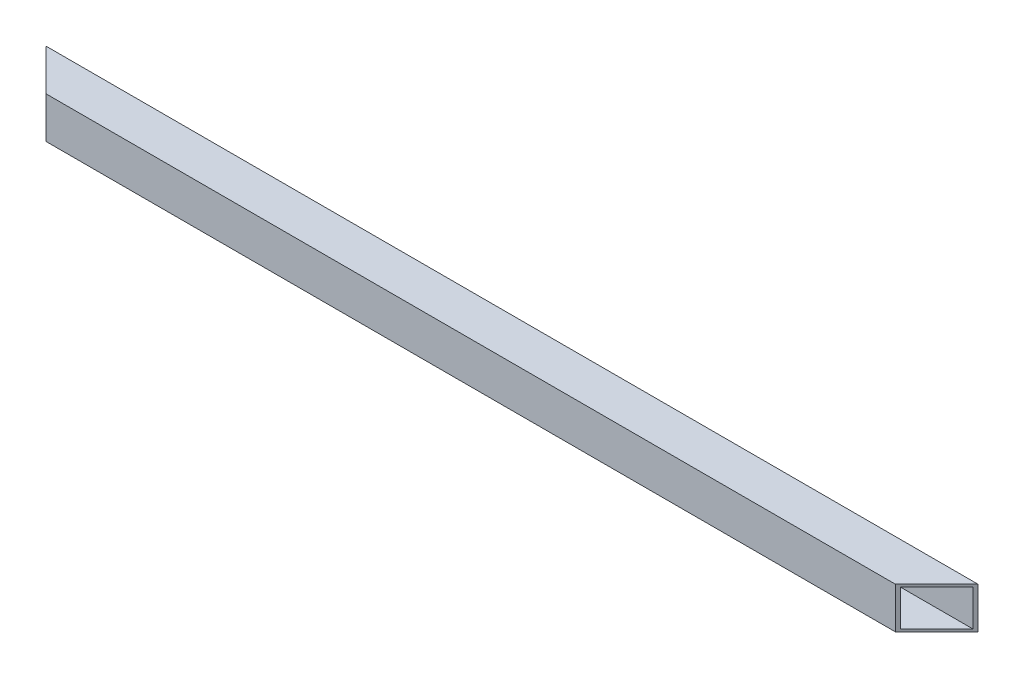
from build123d import *

# Parameters (mm, degrees)
SKETCH1_W               = 19.05
SKETCH1_H               = 19.05
BOSS_EXTRUDE1_DEPTH     = 215
SKETCH2_W               = 16.65
SKETCH2_H               = 16.65
CUT_EXTRUDE1_DEPTH      = 431.210938087
CUT_EXTRUDE2_DEPTH      = 216.421566353
CUT_EXTRUDE2_DEPTH_BACK = 216.421566353


with BuildPart() as part:
    # Sketch1 → Boss-Extrude1 (new, symmetric)
    with BuildSketch(Plane(origin=(0, 0, 0), x_dir=(0, 0, -1), z_dir=(1, 0, 0))):
        Rectangle(SKETCH1_W, SKETCH1_H)
    extrude(amount=BOSS_EXTRUDE1_DEPTH, both=True)

    # Sketch2 → Cut-Extrude1 (cut, through all)
    with BuildSketch(Plane.ZY.offset(215)):
        Rectangle(SKETCH2_W, SKETCH2_H)
    extrude(amount=-CUT_EXTRUDE1_DEPTH, mode=Mode.SUBTRACT)

    # Sketch3 → Cut-Extrude2 (cut, two sides: drawn at the far end of the back side and taken through both)
    with BuildSketch(Plane(origin=(0, 0, 0), x_dir=(1, 0, 0), z_dir=(0, 1, 0)).offset(-CUT_EXTRUDE2_DEPTH_BACK)):
        Polygon((-215, 9.525), (-215, -9.525), (-195.95, -9.525), align=None)
        Polygon((215, -9.525), (195.95, -9.525), (215, 9.525), align=None)
    extrude(amount=CUT_EXTRUDE2_DEPTH + CUT_EXTRUDE2_DEPTH_BACK, mode=Mode.SUBTRACT)


solid = part.part
